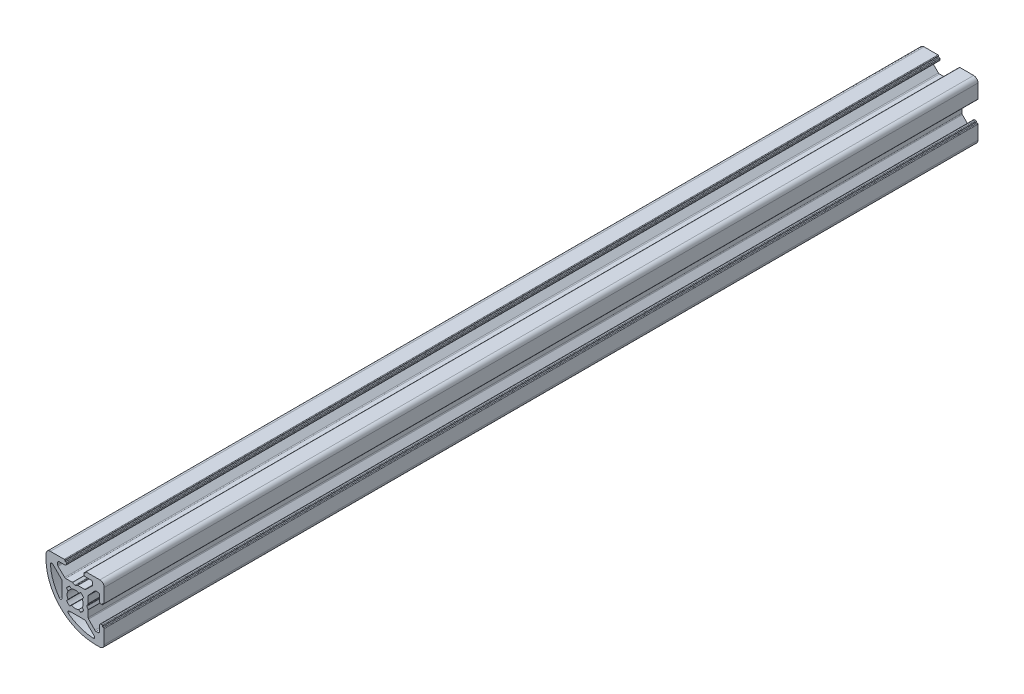
from build123d import *

# Parameters (mm, degrees)
EXTRUDE1_DEPTH = 300


with BuildPart() as part:
    # Sketch1 → Extrude1 (new body)
    with BuildSketch(Plane.XY):
        with BuildLine():
            Line((3.232233116, 4.565447254), (0.953589838, 4.565447254))
            ThreePointArc((0.953589838, 4.565447254), (0.901826028, 4.558632419), (0.853589836, 4.538652333))
            Line((0.853589836, 4.538652333), (0.100000003, 4.103567024))
            ThreePointArc((0.100000003, 4.103567024), (0, 4.076772104), (-0.100000003, 4.103567024))
            Line((-0.100000003, 4.103567024), (-0.853589836, 4.538652333))
            ThreePointArc((-0.853589836, 4.538652333), (-0.901826028, 4.558632419), (-0.953589838, 4.565447254))
            Line((-0.953589838, 4.565447254), (-3.232233116, 4.565447254))
            ThreePointArc((-3.232233116, 4.565447254), (-3.417445277, 4.601015929), (-3.576306433, 4.702661433))
            Line((-3.576306433, 4.702661433), (-5.844073317, 6.853456827))
            ThreePointArc((-5.844073317, 6.853456827), (-5.959367314, 7.018804885), (-6, 7.216242649))
            Line((-6, 7.216242649), (-6, 7.948478858))
            ThreePointArc((-6, 7.948478858), (-5.855954134, 8.296236342), (-5.50819665, 8.440282208))
            Line((-5.50819665, 8.440282208), (-3.49180335, 8.440282208))
            ThreePointArc((-3.49180335, 8.440282208), (-3.144045866, 8.584328074), (-3, 8.932085558))
            Line((-3, 8.932085558), (-3, 9.249999634))
            ThreePointArc((-3, 9.249999634), (-3.058578644, 9.39142099), (-3.2, 9.449999634))
            Line((-3.2, 9.449999634), (-3.350000366, 9.449999634))
            ThreePointArc((-3.350000366, 9.449999634), (-3.491421722, 9.508578278), (-3.550000366, 9.649999634))
            Line((-3.550000366, 9.649999634), (-3.550000366, 9.8))
            ThreePointArc((-3.550000366, 9.8), (-3.60857901, 9.941421356), (-3.750000366, 10))
            Line((-3.750000366, 10), (-8.50000115, 10))
            ThreePointArc((-8.50000115, 10), (-9.560660508, 9.560660508), (-10, 8.50000115))
            Line((-10, 8.50000115), (-10, 7))
            ThreePointArc((-10, 7), (-5.02081528, -5.02081528), (7, -10))
            Line((7, -10), (8.50000115, -10))
            ThreePointArc((8.50000115, -10), (9.560660508, -9.560660508), (10, -8.50000115))
            Line((10, -8.50000115), (10, -3.750000366))
            ThreePointArc((10, -3.750000366), (9.941421356, -3.60857901), (9.8, -3.550000366))
            Line((9.8, -3.550000366), (9.649999634, -3.550000366))
            ThreePointArc((9.649999634, -3.550000366), (9.508578278, -3.491421722), (9.449999634, -3.350000366))
            Line((9.449999634, -3.350000366), (9.449999634, -3.2))
            ThreePointArc((9.449999634, -3.2), (9.39142099, -3.058578644), (9.249999634, -3))
            Line((9.249999634, -3), (8.866638303, -3))
            ThreePointArc((8.866638303, -3), (8.518880819, -3.144045866), (8.374834953, -3.49180335))
            Line((8.374834953, -3.49180335), (8.374834953, -5.50819665))
            ThreePointArc((8.374834953, -5.50819665), (8.230789087, -5.855954134), (7.883031603, -6))
            Line((7.883031603, -6), (7.150795394, -6))
            ThreePointArc((7.150795394, -6), (6.95335763, -5.959367314), (6.788009572, -5.844073317))
            Line((6.788009572, -5.844073317), (4.637214178, -3.576306432))
            ThreePointArc((4.637214178, -3.576306432), (4.535568675, -3.417445276), (4.5, -3.232233115))
            Line((4.5, -3.232233115), (4.5, -0.953589838))
            ThreePointArc((4.5, -0.953589838), (4.493185165, -0.901826026), (4.473205078, -0.853589834))
            Line((4.473205078, -0.853589834), (4.038119764, -0.100000004))
            ThreePointArc((4.038119764, -0.100000004), (4.011324842, 0), (4.038119764, 0.100000004))
            Line((4.038119764, 0.100000004), (4.473205078, 0.853589834))
            ThreePointArc((4.473205078, 0.853589834), (4.493185165, 0.901826026), (4.5, 0.953589838))
            Line((4.5, 0.953589838), (4.5, 3.232233115))
            ThreePointArc((4.5, 3.232233115), (4.535568675, 3.417445276), (4.637214178, 3.576306432))
            Line((4.637214178, 3.576306432), (6.788009572, 5.844073317))
            ThreePointArc((6.788009572, 5.844073317), (6.95335763, 5.959367314), (7.150795394, 6))
            Line((7.150795394, 6), (7.883031603, 6))
            ThreePointArc((7.883031603, 6), (8.230789087, 5.855954134), (8.374834953, 5.50819665))
            Line((8.374834953, 5.50819665), (8.374834953, 3.49180335))
            ThreePointArc((8.374834953, 3.49180335), (8.518880819, 3.144045866), (8.866638303, 3))
            Line((8.866638303, 3), (9.249999634, 3))
            ThreePointArc((9.249999634, 3), (9.39142099, 3.058578644), (9.449999634, 3.2))
            Line((9.449999634, 3.2), (9.449999634, 3.350000366))
            ThreePointArc((9.449999634, 3.350000366), (9.508578278, 3.491421722), (9.649999634, 3.550000366))
            Line((9.649999634, 3.550000366), (9.8, 3.550000366))
            ThreePointArc((9.8, 3.550000366), (9.941421356, 3.60857901), (10, 3.750000366))
            Line((10, 3.750000366), (10, 8.50000115))
            ThreePointArc((10, 8.50000115), (9.560660508, 9.560660508), (8.50000115, 10))
            Line((8.50000115, 10), (3.750000366, 10))
            ThreePointArc((3.750000366, 10), (3.60857901, 9.941421356), (3.550000366, 9.8))
            Line((3.550000366, 9.8), (3.550000366, 9.649999634))
            ThreePointArc((3.550000366, 9.649999634), (3.491421722, 9.508578278), (3.350000366, 9.449999634))
            Line((3.350000366, 9.449999634), (3.2, 9.449999634))
            ThreePointArc((3.2, 9.449999634), (3.058578644, 9.39142099), (3, 9.249999634))
            Line((3, 9.249999634), (3, 8.932085558))
            ThreePointArc((3, 8.932085558), (3.144045866, 8.584328074), (3.49180335, 8.440282208))
            Line((3.49180335, 8.440282208), (5.50819665, 8.440282208))
            ThreePointArc((5.50819665, 8.440282208), (5.855954134, 8.296236342), (6, 7.948478858))
            Line((6, 7.948478858), (6, 7.216242649))
            ThreePointArc((6, 7.216242649), (5.959367314, 7.018804885), (5.844073317, 6.853456827))
            Line((5.844073317, 6.853456827), (3.576306433, 4.702661433))
            ThreePointArc((3.576306433, 4.702661433), (3.417445277, 4.601015929), (3.232233116, 4.565447254))
        make_face()
        with BuildLine():
            Line((1.258185436, 2.445295362), (1.887055008, 2.947714945))
            ThreePointArc((1.887055008, 2.947714945), (2.474873794, 2.474873674), (2.947715037, 1.887054865))
            Line((2.947715037, 1.887054865), (2.445295423, 1.258185317))
            ThreePointArc((2.445295423, 1.258185317), (2.75, -6.7e-08), (2.445295362, -1.258185436))
            Line((2.445295362, -1.258185436), (2.947714945, -1.887055008))
            ThreePointArc((2.947714945, -1.887055008), (2.474873674, -2.474873794), (1.887054865, -2.947715037))
            Line((1.887054865, -2.947715037), (1.258185317, -2.445295423))
            ThreePointArc((1.258185317, -2.445295423), (-6.7e-08, -2.75), (-1.258185436, -2.445295362))
            Line((-1.258185436, -2.445295362), (-1.887055008, -2.947714945))
            ThreePointArc((-1.887055008, -2.947714945), (-2.474873794, -2.474873674), (-2.947715037, -1.887054865))
            Line((-2.947715037, -1.887054865), (-2.445295423, -1.258185317))
            ThreePointArc((-2.445295423, -1.258185317), (-2.75, 6.7e-08), (-2.445295362, 1.258185436))
            Line((-2.445295362, 1.258185436), (-2.947714945, 1.887055008))
            ThreePointArc((-2.947714945, 1.887055008), (-2.474873674, 2.474873794), (-1.887054865, 2.947715037))
            Line((-1.887054865, 2.947715037), (-1.258185317, 2.445295423))
            ThreePointArc((-1.258185317, 2.445295423), (6.7e-08, 2.75), (1.258185436, 2.445295362))
        make_face(mode=Mode.SUBTRACT)
        with BuildLine():
            Line((3.232233163, -4.499999714), (-2.000000051, -4.499999587))
            ThreePointArc((-2.000000051, -4.499999587), (-2.474341709, -4.841885693), (-2.300000072, -5.399999581))
            ThreePointArc((-2.300000072, -5.399999581), (1.713541858, -7.57063318), (6.185210557, -8.478569349))
            ThreePointArc((6.185210557, -8.478569349), (6.668243282, -8.182681825), (6.565047479, -7.625707261))
            Line((6.565047479, -7.625707261), (3.585786542, -4.646446324))
            ThreePointArc((3.585786542, -4.646446324), (3.423574873, -4.53805995), (3.232233163, -4.499999714))
        make_face(mode=Mode.SUBTRACT)
        with BuildLine():
            Line((-4.646446492, 3.585787135), (-7.625707283, 6.565048217))
            ThreePointArc((-7.625707283, 6.565048217), (-8.182681843, 6.668244047), (-8.47856939, 6.185211338))
            ThreePointArc((-8.47856939, 6.185211338), (-7.570633447, 1.713542596), (-5.400000054, -2.299999441))
            ThreePointArc((-5.400000054, -2.299999441), (-4.841886176, -2.474341107), (-4.500000045, -1.999999467))
            Line((-4.500000045, -1.999999467), (-4.499999899, 3.232233748))
            ThreePointArc((-4.499999899, 3.232233748), (-4.538060126, 3.42357546), (-4.646446492, 3.585787135))
        make_face(mode=Mode.SUBTRACT)
    extrude(amount=EXTRUDE1_DEPTH)


solid = part.part
